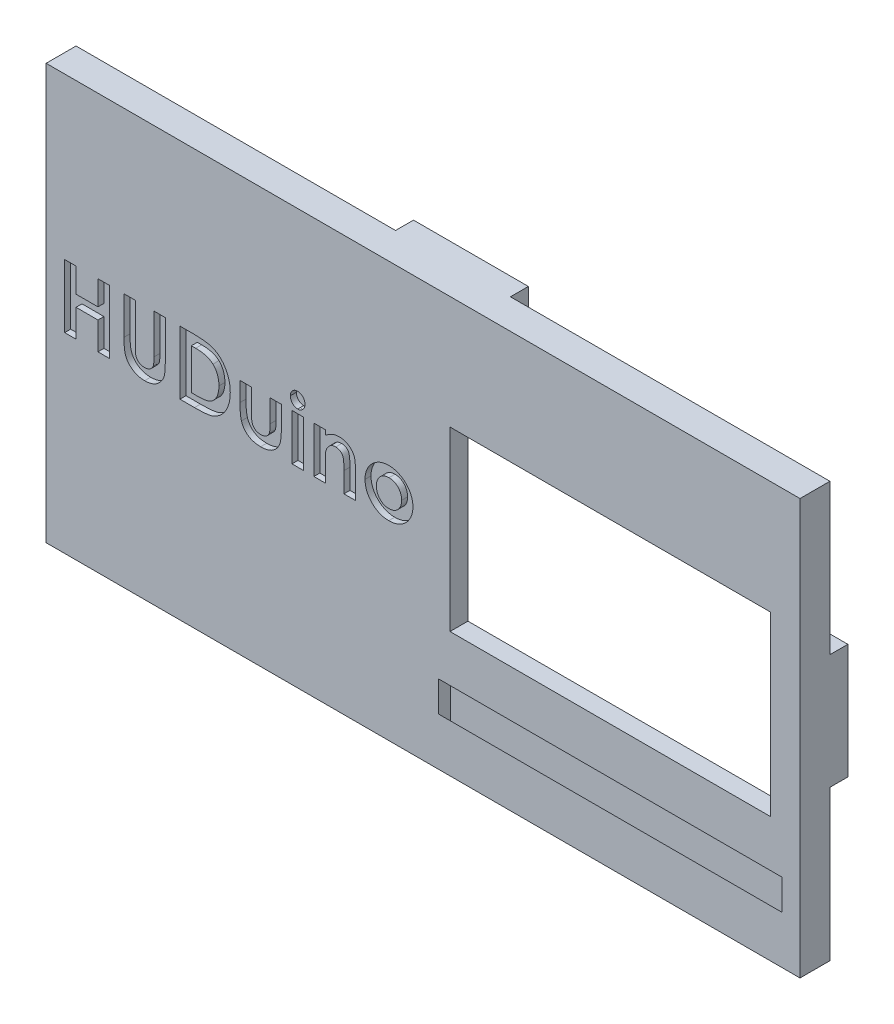
from build123d import *

# Parameters (mm, degrees)
CROQUIS1_W              = 63
CROQUIS1_H              = 34.7
SALIENTE_EXTRUIR1_DEPTH = 1.5
CROQUIS3_W              = 63
CROQUIS3_H              = 34.7
CROQUIS3_W_2            = 60
CROQUIS3_H_2            = 31.7
SALIENTE_EXTRUIR2_DEPTH = 1
CROQUIS4_W              = 9.6
CROQUIS4_H              = 1.5
CROQUIS4_W_2            = 1.5
CROQUIS4_H_2            = 9.6
SALIENTE_EXTRUIR3_DEPTH = 1.5
CROQUIS6_W              = 26.8
CROQUIS6_H              = 14.8
CORTAR_EXTRUIR1_DEPTH   = 21.5
CORTAR_EXTRUIR2_DEPTH   = 32
CROQUIS9_W              = 4.561385857
CROQUIS9_H              = 7.624030645
CROQUIS9_W_2            = 1.5
CROQUIS9_H_2            = 6.813692183
SALIENTE_EXTRUIR4_DEPTH = 1.5
CROQUIS10_W             = 28.7
CROQUIS10_H             = 6.574342804
SALIENTE_EXTRUIR5_DEPTH = 0.5
CROQUIS12_W             = 0.949786325
CROQUIS12_H             = 3.86698718
CORTAR_EXTRUIR3_DEPTH   = 0.5


with BuildPart() as part:
    # Croquis1 → Saliente-Extruir1 (new body)
    with BuildSketch(Plane.XY):
        with Locations((1.705737566, -2.941240876)):
            Rectangle(CROQUIS1_W, CROQUIS1_H)
    extrude(amount=SALIENTE_EXTRUIR1_DEPTH)

    # Croquis3 → Saliente-Extruir2 (add)
    with BuildSketch(Plane(origin=(0, 0, 0), x_dir=(-1, 0, 0), z_dir=(0, 0, -1))):
        with Locations((-1.705737566, -2.941240876)):
            Rectangle(CROQUIS3_W, CROQUIS3_H)
        with Locations((-1.705737566, -2.941240876)):
            Rectangle(CROQUIS3_W_2, CROQUIS3_H_2, mode=Mode.SUBTRACT)
    extrude(amount=SALIENTE_EXTRUIR2_DEPTH)

    # Croquis4 → Saliente-Extruir3 (add)
    with BuildSketch(Plane(origin=(0, 0, -1), x_dir=(-1, 0, 0), z_dir=(0, 0, -1))):
        with Locations((-1.705737566, 13.658759124)):
            Rectangle(CROQUIS4_W, CROQUIS4_H)
        with Locations((-32.455737566, -2.941240876)):
            Rectangle(CROQUIS4_W_2, CROQUIS4_H_2)
        with Locations((-1.705737566, -19.541240876)):
            Rectangle(CROQUIS4_W, CROQUIS4_H)
        with Locations((29.044262434, -2.941240876)):
            Rectangle(CROQUIS4_W_2, CROQUIS4_H_2)
    extrude(amount=SALIENTE_EXTRUIR3_DEPTH)

    # Croquis6 → Cortar-Extruir1 (cut)
    with BuildSketch(Plane.XY.offset(1.5)):
        with Locations((17.355737566, -2.441240876)):
            Rectangle(CROQUIS6_W, CROQUIS6_H)
    extrude(amount=-CORTAR_EXTRUIR1_DEPTH, mode=Mode.SUBTRACT)

    # Croquis8 → Cortar-Extruir2 (cut)
    with BuildSketch(Plane(origin=(33.205737566, 0, 0), x_dir=(0, 0, -1), z_dir=(1, 0, 0))):
        Polygon((0, -15.245656464), (-2.710635827, -12.535020636), (-2.868202565, -14.923038311), (0, -17.791240876), align=None)
    extrude(amount=-CORTAR_EXTRUIR2_DEPTH, mode=Mode.SUBTRACT)

    # Croquis9 → Saliente-Extruir4 (add)
    with BuildSketch(Plane.XY.offset(1.5)):
        with Locations((0.725044638, -15.289564016)):
            Rectangle(CROQUIS9_W, CROQUIS9_H)
        with Locations((32.455737566, -14.884394784)):
            Rectangle(CROQUIS9_W_2, CROQUIS9_H_2)
    extrude(amount=-SALIENTE_EXTRUIR4_DEPTH)

    # Croquis10 → Saliente-Extruir5 (add)
    with BuildSketch(Plane(origin=(0, 0, 0), x_dir=(-1, 0, 0), z_dir=(0, 0, -1))):
        with Locations((-17.355737566, -14.504069474)):
            Rectangle(CROQUIS10_W, CROQUIS10_H)
    extrude(amount=-SALIENTE_EXTRUIR5_DEPTH)

    # Croquis12 → Cortar-Extruir3 (cut)
    # profile 1 of 8: a face of its own
    with BuildSketch(Plane.XY.offset(1.5)):
        Polygon((-28.244970749, 0.982010034), (-27.295184424, 0.982010034), (-27.295184424, -1.053246376), (-25.463453655, -1.053246376), (-25.463453655, 0.982010034), (-24.51366733, 0.982010034), (-24.51366733, -4.309656633), (-25.463453655, -4.309656633), (-25.463453655, -2.003032701), (-27.295184424, -2.003032701), (-27.295184424, -4.309656633), (-28.244970749, -4.309656633), align=None)
    # profile 2 of 8: a face of its own
    with BuildSketch(Plane.XY.offset(1.5)):
        with BuildLine():
            Line((-23.292513484, 0.982010034), (-22.342727159, 0.982010034))
            Line((-22.342727159, 0.982010034), (-22.342727159, -2.460965394))
            add(Edge.make_bspline(
                [(-22.342727159, -2.460965394), (-22.342675514, -2.496660669), (-22.342575763, -2.565605726), (-22.337582166, -2.664519309), (-22.333012681, -2.755441603), (-22.324768032, -2.838273066), (-22.31258786, -2.913049131), (-22.300793478, -2.980250132), (-22.28483095, -3.038672913), (-22.260841821, -3.105173333), (-22.223882449, -3.179890187), (-22.163492886, -3.257761806), (-22.093808496, -3.328830961), (-22.010287741, -3.387986233), (-21.916417799, -3.435837516), (-21.812714443, -3.471290021), (-21.699323859, -3.490996907), (-21.620920489, -3.494005524), (-21.580566034, -3.495554069)],
                knots=[0, 0, 0, 0, 1.155499968, 2.231836252, 3.205919964, 4.102923608, 4.924856345, 5.658536265, 6.31071849, 6.882491295, 7.94666036, 8.992281882, 10.060072772, 11.158554251, 12.289267114, 13.461410017, 14.693379945, 16, 16, 16, 16], degree=3))
            add(Edge.make_bspline(
                [(-21.580566034, -3.495554069), (-21.537694406, -3.494303044), (-21.454101989, -3.491863756), (-21.333867606, -3.467919512), (-21.222469767, -3.429792075), (-21.122267146, -3.375374505), (-21.03335946, -3.31014551), (-20.958100967, -3.235764016), (-20.898707241, -3.152081667), (-20.85999662, -3.074878328), (-20.838262513, -3.003819378), (-20.821971717, -2.940330902), (-20.810028761, -2.865420785), (-20.799193719, -2.780258909), (-20.792682693, -2.683963163), (-20.785622547, -2.577307968), (-20.783034938, -2.459563562), (-20.782593899, -2.377575921), (-20.782363911, -2.334821897)],
                knots=[0, 0, 0, 0, 1.261321664, 2.459363699, 3.594844139, 4.716940403, 5.803436589, 6.833651888, 7.818396249, 8.814403945, 9.360733334, 10.004355033, 10.743453831, 11.592799886, 12.532235708, 13.585170094, 14.740740724, 16, 16, 16, 16], degree=3))
            Line((-20.782363911, -2.334821897), (-20.782363911, 0.982010034))
            Line((-20.782363911, 0.982010034), (-19.832577586, 0.982010034))
            Line((-19.832577586, 0.982010034), (-19.832577586, -2.174757461))
            add(Edge.make_bspline(
                [(-19.832577586, -2.174757461), (-19.832709481, -2.238713419), (-19.832963103, -2.36169449), (-19.836857963, -2.538426944), (-19.845149416, -2.699843691), (-19.85211328, -2.845991897), (-19.865590741, -2.976674676), (-19.879631094, -3.092450082), (-19.897526732, -3.192907832), (-19.924154365, -3.307266773), (-19.970105777, -3.438946904), (-20.044185478, -3.590570867), (-20.138224863, -3.739019912), (-20.249374717, -3.882660995), (-20.374873069, -4.016098933), (-20.511937352, -4.13324017), (-20.658389955, -4.232329025), (-20.815761204, -4.310942655), (-20.983917167, -4.372255361), (-21.164521622, -4.413454411), (-21.357451411, -4.441289006), (-21.490711663, -4.443962861), (-21.559365447, -4.445340394)],
                knots=[0, 0, 0, 0, 1.170808336, 2.251350247, 3.235597562, 4.129743112, 4.929140599, 5.639994148, 6.264258765, 6.79612947, 7.788252245, 8.809469599, 9.879094798, 10.999557536, 12.129761673, 13.226370002, 14.293821979, 15.358369427, 16.438775801, 17.562147481, 18.744053101, 20, 20, 20, 20], degree=3))
            add(Edge.make_bspline(
                [(-21.559365447, -4.445340394), (-21.604980387, -4.44457207), (-21.694977727, -4.443056184), (-21.827334605, -4.429690026), (-21.955283527, -4.409993335), (-22.078584078, -4.381257891), (-22.197664212, -4.344137065), (-22.312492292, -4.298443914), (-22.422641589, -4.244433307), (-22.527495723, -4.182602026), (-22.626925661, -4.11574214), (-22.717799493, -4.041625141), (-22.803244399, -3.965732262), (-22.880791912, -3.884869609), (-22.951024483, -3.799886101), (-23.013797467, -3.710589137), (-23.069017606, -3.61698665), (-23.118073931, -3.51739146), (-23.160061357, -3.406741503), (-23.195458335, -3.281100915), (-23.226381967, -3.138500405), (-23.249362587, -2.978618701), (-23.270196951, -2.801982756), (-23.283383955, -2.608132406), (-23.29028267, -2.397062089), (-23.29175109, -2.250731415), (-23.292513484, -2.174757461)],
                knots=[0, 0, 0, 0, 1.001158378, 1.975264943, 2.917723546, 3.841610987, 4.75185031, 5.653588123, 6.552117133, 7.442167995, 8.324307438, 9.179605724, 10.014504199, 10.831958861, 11.636465792, 12.43274043, 13.225645099, 14.020104002, 14.867201867, 15.819789774, 16.883317127, 18.068162734, 19.364263498, 20.787406516, 22.332041935, 24, 24, 24, 24], degree=3))
            Line((-23.292513484, -2.174757461), (-23.292513484, 0.982010034))
        make_face()
    # profile 3 of 8: a face of its own
    with BuildSketch(Plane.XY.offset(1.5)):
        with BuildLine():
            Line((-18.61142374, 0.982010034), (-17.41465057, 0.982010034))
            add(Edge.make_bspline(
                [(-17.41465057, 0.982010034), (-17.321348336, 0.981357819), (-17.140994063, 0.980097081), (-16.879696401, 0.965891595), (-16.636722826, 0.944044565), (-16.411916713, 0.913990017), (-16.205738951, 0.874219619), (-16.0184554, 0.824335449), (-15.849437494, 0.766752475), (-15.696831985, 0.69899442), (-15.557517833, 0.619995258), (-15.4252346, 0.531996533), (-15.30024202, 0.431774596), (-15.180786021, 0.321262928), (-15.068408207, 0.19843975), (-14.961237085, 0.065339461), (-14.86189669, -0.079968078), (-14.767384178, -0.23399885), (-14.681910186, -0.397405623), (-14.607356578, -0.568797513), (-14.544902567, -0.747071548), (-14.49415545, -0.932417723), (-14.45370414, -1.124220745), (-14.425401174, -1.322867654), (-14.407903999, -1.528174536), (-14.406129057, -1.667321091), (-14.405227159, -1.738025356)],
                knots=[0, 0, 0, 0, 1.44355588, 2.790409838, 4.047694926, 5.217575253, 6.298404546, 7.294384826, 8.214239204, 9.058592145, 9.873746385, 10.689560431, 11.514393297, 12.350027578, 13.205127629, 14.088021785, 14.991911688, 15.926770944, 16.882954281, 17.842803888, 18.816321264, 19.80318086, 20.814351908, 21.847355356, 22.906180909, 24, 24, 24, 24], degree=3))
            add(Edge.make_bspline(
                [(-14.405227159, -1.738025356), (-14.407588814, -1.837793677), (-14.412237872, -2.034193456), (-14.451398932, -2.322407869), (-14.514735626, -2.59869013), (-14.603792771, -2.860879052), (-14.71419979, -3.106639803), (-14.846093338, -3.331638497), (-14.997539547, -3.534667455), (-15.166774062, -3.714715757), (-15.350013824, -3.869469713), (-15.540436887, -4.002005152), (-15.73989832, -4.106520404), (-15.915651717, -4.172798703), (-16.068051839, -4.214018071), (-16.201857497, -4.238379115), (-16.353847072, -4.260719661), (-16.525437735, -4.277983954), (-16.715876755, -4.293379461), (-16.925923223, -4.301744781), (-17.15489707, -4.308695119), (-17.313941057, -4.30932773), (-17.39663007, -4.309656633)],
                knots=[0, 0, 0, 0, 1.315458931, 2.589557908, 3.828601765, 5.048913369, 6.235739168, 7.376350998, 8.481830359, 9.569842114, 10.627874879, 11.640079404, 12.624025415, 13.590060155, 14.111227486, 14.704434459, 15.382649715, 16.137166398, 16.978595427, 17.902333227, 18.909396075, 20, 20, 20, 20], degree=3))
            Line((-17.39663007, -4.309656633), (-18.61142374, -4.309656633))
            Line((-18.61142374, -4.309656633), (-18.61142374, 0.982010034))
        make_face()
        with BuildLine():
            Line((-17.661637415, 0.032223709), (-17.661637415, -3.359870308))
            Line((-17.661637415, -3.359870308), (-17.165543665, -3.359870308))
            add(Edge.make_bspline(
                [(-17.165543665, -3.359870308), (-17.106516128, -3.359762145), (-16.992986523, -3.359554112), (-16.829075472, -3.349645309), (-16.677499311, -3.339699604), (-16.538675294, -3.320822322), (-16.411593101, -3.299794359), (-16.297998511, -3.270531069), (-16.195549844, -3.239792461), (-16.105498492, -3.200658404), (-16.023018791, -3.156610419), (-15.946652009, -3.105003097), (-15.872936683, -3.047695112), (-15.803250981, -2.983000956), (-15.737331159, -2.911777299), (-15.675567241, -2.833657159), (-15.617134842, -2.748878881), (-15.56353381, -2.656994223), (-15.5145529, -2.558973507), (-15.471101345, -2.455766207), (-15.435073593, -2.346512827), (-15.405129532, -2.232236112), (-15.383731105, -2.111941152), (-15.366027988, -1.986518956), (-15.356901515, -1.855472611), (-15.355648964, -1.766304298), (-15.355013484, -1.721064886)],
                knots=[0, 0, 0, 0, 1.50275155, 2.890291501, 4.180787663, 5.369391935, 6.45668281, 7.458360028, 8.354766181, 9.177074746, 9.954075863, 10.732690366, 11.5210699, 12.329727389, 13.151100085, 13.990027547, 14.863562427, 15.770965086, 16.696477834, 17.652329173, 18.619756807, 19.62365428, 20.657822005, 21.729286259, 22.847956731, 24, 24, 24, 24], degree=3))
            add(Edge.make_bspline(
                [(-15.355013484, -1.721064886), (-15.356279144, -1.651739764), (-15.358747085, -1.516561147), (-15.382547367, -1.319670541), (-15.421289687, -1.13426854), (-15.476571244, -0.96104322), (-15.546255361, -0.799507728), (-15.633481276, -0.651030611), (-15.734495124, -0.513117657), (-15.814374118, -0.432213494), (-15.854287322, -0.391788043)],
                knots=[0, 0, 0, 0, 1.13821349, 2.219428113, 3.251817212, 4.244760574, 5.201143372, 6.134805572, 7.068016741, 8, 8, 8, 8], degree=3))
            add(Edge.make_bspline(
                [(-15.854287322, -0.391788043), (-15.89364552, -0.357340094), (-15.974030184, -0.286984058), (-16.115159237, -0.202679535), (-16.270676144, -0.128609748), (-16.444138667, -0.069880668), (-16.633870365, -0.023435207), (-16.841001287, 0.008597092), (-17.064422199, 0.029180707), (-17.219203002, 0.031187644), (-17.299107367, 0.032223709)],
                knots=[0, 0, 0, 0, 0.813307809, 1.661089106, 2.549956539, 3.493439533, 4.508053171, 5.589449661, 6.755572447, 8, 8, 8, 8], degree=3))
            Line((-17.299107367, 0.032223709), (-17.661637415, 0.032223709))
        make_face(mode=Mode.SUBTRACT)
    # profile 4 of 8: a face of its own
    with BuildSketch(Plane.XY.offset(1.5)):
        with BuildLine():
            Line((-13.591124595, -0.442669453), (-12.64133827, -0.442669453))
            Line((-12.64133827, -0.442669453), (-12.64133827, -2.298780898))
            add(Edge.make_bspline(
                [(-12.64133827, -2.298780898), (-12.641253929, -2.342246548), (-12.641092056, -2.425667745), (-12.636587688, -2.545476915), (-12.630267168, -2.655036915), (-12.622379587, -2.754476935), (-12.610606867, -2.843557791), (-12.597015758, -2.922109423), (-12.581607825, -2.990697806), (-12.556552579, -3.067148704), (-12.517353196, -3.150809508), (-12.458155188, -3.239625275), (-12.386449134, -3.316424945), (-12.303203831, -3.381890074), (-12.207569141, -3.433478033), (-12.100862658, -3.468438406), (-11.984426967, -3.491935411), (-11.903329683, -3.49431606), (-11.861156646, -3.495554069)],
                knots=[0, 0, 0, 0, 1.267339619, 2.432334223, 3.495366327, 4.467371443, 5.340232306, 6.114347373, 6.791623365, 7.387877112, 8.457231658, 9.474542289, 10.487879852, 11.508108106, 12.54995813, 13.638205937, 14.771795776, 16, 16, 16, 16], degree=3))
            add(Edge.make_bspline(
                [(-11.861156646, -3.495554069), (-11.819021034, -3.494141056), (-11.737714019, -3.491414436), (-11.620503637, -3.470151527), (-11.513545818, -3.433716823), (-11.415742038, -3.384297447), (-11.329976536, -3.31815803), (-11.255304021, -3.239348223), (-11.192431515, -3.146596726), (-11.162218377, -3.077406767), (-11.146696844, -3.041861494)],
                knots=[0, 0, 0, 0, 1.116871431, 2.155171802, 3.144773418, 4.104381479, 5.046960687, 6.001340237, 6.973219418, 8, 8, 8, 8], degree=3))
            add(Edge.make_bspline(
                [(-11.146696844, -3.041861494), (-11.141000963, -3.026071965), (-11.128427962, -2.991218401), (-11.117237742, -2.931091207), (-11.105193734, -2.860180916), (-11.095666496, -2.777042438), (-11.090275648, -2.682190656), (-11.084499906, -2.575506024), (-11.081556485, -2.457094795), (-11.081174778, -2.374044115), (-11.080975022, -2.33058178)],
                knots=[0, 0, 0, 0, 0.56094539, 1.238222264, 2.041156151, 2.969685991, 4.036367568, 5.220421584, 6.545382566, 8, 8, 8, 8], degree=3))
            Line((-11.080975022, -2.33058178), (-11.080975022, -0.442669453))
            Line((-11.080975022, -0.442669453), (-10.131188697, -0.442669453))
            Line((-10.131188697, -0.442669453), (-10.131188697, -2.067694493))
            add(Edge.make_bspline(
                [(-10.131188697, -2.067694493), (-10.131353152, -2.148266681), (-10.131668461, -2.302747951), (-10.140705029, -2.524346313), (-10.153176517, -2.725823454), (-10.169237394, -2.907734104), (-10.192379134, -3.070153756), (-10.220786852, -3.212701533), (-10.252214858, -3.336319409), (-10.281035511, -3.409563855), (-10.294433222, -3.443612629)],
                knots=[0, 0, 0, 0, 1.388070971, 2.661352173, 3.82033814, 4.865898334, 5.806910977, 6.645039373, 7.370126333, 8, 8, 8, 8], degree=3))
            add(Edge.make_bspline(
                [(-10.294433222, -3.443612629), (-10.311605636, -3.480259629), (-10.345502507, -3.552597659), (-10.404319878, -3.655446318), (-10.467728299, -3.752887273), (-10.538744767, -3.842626862), (-10.615919615, -3.925577142), (-10.697071352, -4.003623776), (-10.785854632, -4.073588585), (-10.879966975, -4.137271964), (-10.98072159, -4.193803162), (-11.087428381, -4.243899378), (-11.201240483, -4.284669109), (-11.321171012, -4.319227205), (-11.447772769, -4.344998956), (-11.580790728, -4.36451909), (-11.720370779, -4.37460717), (-11.815561789, -4.376518941), (-11.864336734, -4.377498513)],
                knots=[0, 0, 0, 0, 0.997311338, 1.968606903, 2.91805772, 3.860812155, 4.785445165, 5.709667791, 6.633356648, 7.568312411, 8.508286151, 9.478643871, 10.470653671, 11.485274776, 12.552984541, 13.653035246, 14.797438149, 16, 16, 16, 16], degree=3))
            add(Edge.make_bspline(
                [(-11.864336734, -4.377498513), (-11.917027381, -4.37687058), (-12.020125109, -4.375641927), (-12.170749449, -4.360595744), (-12.31429647, -4.34112794), (-12.449163479, -4.308029104), (-12.577233956, -4.269682447), (-12.697037579, -4.220741913), (-12.809063896, -4.163201712), (-12.913533335, -4.097402973), (-13.009635667, -4.022742722), (-13.099507837, -3.942448221), (-13.180248383, -3.853324807), (-13.254493158, -3.758124645), (-13.321413546, -3.655971563), (-13.381042763, -3.547228784), (-13.433431318, -3.431401694), (-13.461383211, -3.350223442), (-13.475581392, -3.308988898)],
                knots=[0, 0, 0, 0, 1.211240017, 2.369985978, 3.478996442, 4.539426614, 5.559871561, 6.551301256, 7.510778031, 8.453136967, 9.386094087, 10.30661716, 11.221130616, 12.147659962, 13.080758632, 14.026335491, 14.997475882, 16, 16, 16, 16], degree=3))
            add(Edge.make_bspline(
                [(-13.475581392, -3.308988898), (-13.485267855, -3.276964573), (-13.506134753, -3.207976711), (-13.528664609, -3.093326937), (-13.546684808, -2.961186653), (-13.564214287, -2.811425881), (-13.576443172, -2.643793546), (-13.584436117, -2.458555871), (-13.589836702, -2.255350624), (-13.59068265, -2.113986184), (-13.591124595, -2.04013373)],
                knots=[0, 0, 0, 0, 0.627914866, 1.352675004, 2.190563461, 3.132055958, 4.183353232, 5.345633452, 6.613289997, 8, 8, 8, 8], degree=3))
            Line((-13.591124595, -2.04013373), (-13.591124595, -0.442669453))
        make_face()
    # profile 5 of 8: a face of its own
    with BuildSketch(Plane.XY.offset(1.5)):
        with BuildLine():
            add(Edge.make_bspline(
                [(-8.776471149, 1.185535675), (-8.735535365, 1.18352721), (-8.65515401, 1.179583397), (-8.539996779, 1.141139988), (-8.43430578, 1.080804206), (-8.340872006, 0.998022075), (-8.263162529, 0.89916507), (-8.203789603, 0.78848808), (-8.17071542, 0.66586154), (-8.166121905, 0.581152409), (-8.163774167, 0.537857723)],
                knots=[0, 0, 0, 0, 0.989868614, 1.943702388, 2.910836514, 3.924849579, 4.949916355, 5.946401046, 6.950409252, 8, 8, 8, 8], degree=3))
            add(Edge.make_bspline(
                [(-8.163774167, 0.537857723), (-8.166037907, 0.494882096), (-8.17044891, 0.41114204), (-8.204550826, 0.290180212), (-8.261540729, 0.179556978), (-8.339879604, 0.082168183), (-8.432300434, 0.000719307), (-8.535682004, -0.060711834), (-8.649735694, -0.097016645), (-8.728869774, -0.101290139), (-8.769050944, -0.103460052)],
                knots=[0, 0, 0, 0, 1.05296456, 2.051751585, 3.055639087, 4.085634717, 5.099016424, 6.062201612, 7.016062274, 8, 8, 8, 8], degree=3))
            add(Edge.make_bspline(
                [(-8.769050944, -0.103460052), (-8.810344063, -0.101458767), (-8.891424733, -0.097529166), (-9.00752649, -0.058995808), (-9.114627137, 0.00086479), (-9.207655596, 0.085338288), (-9.28625502, 0.184897747), (-9.343034513, 0.298151393), (-9.378551491, 0.421616451), (-9.382767325, 0.507580182), (-9.384928014, 0.551638105)],
                knots=[0, 0, 0, 0, 0.989065327, 1.942068821, 2.907541208, 3.917690034, 4.939857478, 5.938239964, 6.943311734, 8, 8, 8, 8], degree=3))
            add(Edge.make_bspline(
                [(-9.384928014, 0.551638105), (-9.382576593, 0.593883981), (-9.377957567, 0.676869905), (-9.344685265, 0.796770098), (-9.286673759, 0.905586434), (-9.209524031, 1.002633769), (-9.11691092, 1.083871702), (-9.011283369, 1.142375046), (-8.89690115, 1.179230633), (-8.817028982, 1.183412294), (-8.776471149, 1.185535675)],
                knots=[0, 0, 0, 0, 1.038616768, 2.040212704, 3.031499824, 4.052181184, 5.074969369, 6.039807101, 7.004644834, 8, 8, 8, 8], degree=3))
        make_face()
    # profile 6 of 8: a face of its own
    with BuildSketch(Plane.XY.offset(1.5)):
        with Locations((-8.774351091, -2.376163043)):
            Rectangle(CROQUIS12_W, CROQUIS12_H)
    # profile 7 of 8: a face of its own
    with BuildSketch(Plane.XY.offset(1.5)):
        with BuildLine():
            Line((-7.417513484, -0.442669453), (-6.467727159, -0.442669453))
            Line((-6.467727159, -0.442669453), (-6.467727159, -0.851840794))
            add(Edge.make_bspline(
                [(-6.467727159, -0.851840794), (-6.41354232, -0.80969471), (-6.309984559, -0.729145351), (-6.152558883, -0.626444508), (-6.003968536, -0.542387992), (-5.860901279, -0.478450304), (-5.720665299, -0.432449887), (-5.580989373, -0.399401332), (-5.439793443, -0.378239433), (-5.344875506, -0.37596425), (-5.297454723, -0.374827573)],
                knots=[0, 0, 0, 0, 1.276643801, 2.439914479, 3.493451431, 4.44993799, 5.350072675, 6.235028322, 7.118224225, 8, 8, 8, 8], degree=3))
            add(Edge.make_bspline(
                [(-5.297454723, -0.374827573), (-5.24935272, -0.376126559), (-5.15492445, -0.378676578), (-5.015884024, -0.396511891), (-4.883044401, -0.428995648), (-4.754911907, -0.47212529), (-4.632790713, -0.529053945), (-4.515184758, -0.596647485), (-4.404620179, -0.678980991), (-4.336529616, -0.741682236), (-4.302087135, -0.77339862)],
                knots=[0, 0, 0, 0, 1.048836932, 2.058954983, 3.049370783, 4.026390553, 5.001981509, 5.982488534, 6.97947532, 8, 8, 8, 8], degree=3))
            add(Edge.make_bspline(
                [(-4.302087135, -0.77339862), (-4.274462997, -0.802790433), (-4.219012547, -0.861789173), (-4.149235121, -0.962751128), (-4.089358242, -1.072818138), (-4.040297459, -1.193259863), (-4.004043517, -1.324738051), (-3.976152864, -1.465664634), (-3.960502933, -1.616828697), (-3.958570875, -1.720676982), (-3.957577586, -1.774066355)],
                knots=[0, 0, 0, 0, 0.889584746, 1.785680191, 2.700364693, 3.65222533, 4.649950538, 5.707241244, 6.821271309, 8, 8, 8, 8], degree=3))
            Line((-3.957577586, -1.774066355), (-3.957577586, -4.309656633))
            Line((-3.957577586, -4.309656633), (-4.907363911, -4.309656633))
            Line((-4.907363911, -4.309656633), (-4.907363911, -2.630570094))
            add(Edge.make_bspline(
                [(-4.907363911, -2.630570094), (-4.90756477, -2.575801217), (-4.907949679, -2.470846828), (-4.910904926, -2.320641324), (-4.916675289, -2.184986249), (-4.921934825, -2.063634612), (-4.932261385, -1.957017294), (-4.941574045, -1.864459326), (-4.955863417, -1.7868004), (-4.974456208, -1.703266574), (-5.006923801, -1.613828337), (-5.057328157, -1.519590378), (-5.12127315, -1.439533131), (-5.196147012, -1.373095355), (-5.281867051, -1.320536981), (-5.377397464, -1.283558891), (-5.482226095, -1.260513237), (-5.555269454, -1.25805082), (-5.59320292, -1.256772017)],
                knots=[0, 0, 0, 0, 1.49886392, 2.872294502, 4.110984203, 5.214877267, 6.195405875, 7.042225351, 7.75923308, 8.355011229, 9.382752534, 10.352059385, 11.267231453, 12.171456522, 13.078624015, 14.003401117, 14.963110155, 16, 16, 16, 16], degree=3))
            add(Edge.make_bspline(
                [(-5.59320292, -1.256772017), (-5.642536989, -1.259273761), (-5.739044017, -1.264167658), (-5.878622128, -1.301072108), (-6.006822297, -1.363835715), (-6.122597023, -1.450687925), (-6.224843649, -1.557917741), (-6.309056684, -1.685801598), (-6.378128672, -1.831253025), (-6.407830654, -1.937456193), (-6.423205925, -1.992432407)],
                knots=[0, 0, 0, 0, 0.984188326, 1.925263693, 2.85911992, 3.81709677, 4.80007086, 5.801799564, 6.862098548, 8, 8, 8, 8], degree=3))
            add(Edge.make_bspline(
                [(-6.423205925, -1.992432407), (-6.427027291, -2.009698056), (-6.435549705, -2.048203924), (-6.442558312, -2.113255378), (-6.452307793, -2.19043263), (-6.455960684, -2.281132372), (-6.46231266, -2.384925358), (-6.464661924, -2.501948905), (-6.467015392, -2.631973549), (-6.467482043, -2.722790822), (-6.467727159, -2.770493973)],
                knots=[0, 0, 0, 0, 0.543362196, 1.211806945, 2.009705693, 2.934833164, 4.000995085, 5.207458376, 6.533175157, 8, 8, 8, 8], degree=3))
            Line((-6.467727159, -2.770493973), (-6.467727159, -4.309656633))
            Line((-6.467727159, -4.309656633), (-7.417513484, -4.309656633))
            Line((-7.417513484, -4.309656633), (-7.417513484, -0.442669453))
        make_face()
    # profile 8 of 8: a face of its own
    with BuildSketch(Plane.XY.offset(1.5)):
        with BuildLine():
            add(Edge.make_bspline(
                [(-1.165460198, -0.374827573), (-1.120556135, -0.375626672), (-1.031625741, -0.377209249), (-0.89917503, -0.390382759), (-0.769039862, -0.411875884), (-0.640472239, -0.439705728), (-0.51466603, -0.478699504), (-0.390961398, -0.525466507), (-0.268252266, -0.579160497), (-0.149584249, -0.643075125), (-0.034100061, -0.712396369), (0.075385822, -0.788863388), (0.177964195, -0.871875561), (0.275539263, -0.959508185), (0.363563869, -1.055576498), (0.447663258, -1.155451527), (0.523293745, -1.262711444), (0.593316682, -1.374742574), (0.655657599, -1.490897063), (0.70978922, -1.610366899), (0.756770378, -1.731500326), (0.793555683, -1.855772834), (0.824010525, -1.981545723), (0.843229694, -2.110360246), (0.856893192, -2.240893155), (0.858425303, -2.328778651), (0.859195918, -2.372982955)],
                knots=[0, 0, 0, 0, 1.022364134, 2.024744242, 3.027414945, 4.024939316, 5.017584196, 6.023349371, 7.035562955, 8.064994934, 9.090267829, 10.101425541, 11.102933353, 12.093946398, 13.084502048, 14.067315274, 15.065326281, 16.070028806, 17.074376865, 18.064572984, 19.055292013, 20.030201733, 21.013838017, 21.999348303, 22.993720005, 24, 24, 24, 24], degree=3))
            add(Edge.make_bspline(
                [(0.859195918, -2.372982955), (0.858382661, -2.417532605), (0.856765722, -2.50610741), (0.843724023, -2.637868142), (0.822148629, -2.76728842), (0.794211972, -2.89513068), (0.755364123, -3.01975906), (0.709974558, -3.143010629), (0.65425708, -3.263205424), (0.592657304, -3.381654656), (0.522184149, -3.494872725), (0.446619129, -3.603207128), (0.362871989, -3.703815744), (0.275552045, -3.799818726), (0.180517512, -3.887969683), (0.079285321, -3.969699952), (-0.02726814, -4.04600872), (-0.139909102, -4.115105642), (-0.257194823, -4.175818643), (-0.377147301, -4.230556369), (-0.500467951, -4.276129433), (-0.626901554, -4.313293012), (-0.756524789, -4.342067841), (-0.88905148, -4.361614925), (-1.024196215, -4.375209696), (-1.115251416, -4.376730663), (-1.161220081, -4.377498513)],
                knots=[0, 0, 0, 0, 1.012026251, 2.012137606, 3.004615893, 3.992048833, 4.982446996, 5.968083444, 6.973977695, 7.990229942, 8.999482246, 10.001782172, 10.988562221, 11.971415814, 12.948383116, 13.930088534, 14.925840678, 15.924049238, 16.929462851, 17.924729459, 18.917889337, 19.913673841, 20.916777188, 21.931792057, 22.95587778, 24, 24, 24, 24], degree=3))
            add(Edge.make_bspline(
                [(-1.161220081, -4.377498513), (-1.228435643, -4.375525604), (-1.360918539, -4.37163697), (-1.556034523, -4.345000842), (-1.743476574, -4.299153084), (-1.923550128, -4.23524232), (-2.096489104, -4.153343057), (-2.260784229, -4.051980282), (-2.418069793, -3.933149538), (-2.565621489, -3.797855192), (-2.700798832, -3.649425044), (-2.818892504, -3.490976764), (-2.919163589, -3.324885228), (-3.001521872, -3.150961034), (-3.065085673, -2.968965686), (-3.110989582, -2.779443285), (-3.137658275, -2.581861112), (-3.14151402, -2.447618084), (-3.143475022, -2.379343131)],
                knots=[0, 0, 0, 0, 1.029999031, 2.030143771, 3.011211297, 3.982305373, 4.953580601, 5.938004764, 6.935448627, 7.970290061, 9.001484052, 10.007591832, 10.993831261, 11.969999897, 12.951306496, 13.942897864, 14.953773953, 16, 16, 16, 16], degree=3))
            add(Edge.make_bspline(
                [(-3.143475022, -2.379343131), (-3.141445634, -2.306440448), (-3.137456913, -2.163151683), (-3.105784708, -1.953230378), (-3.055207613, -1.752240676), (-2.98260738, -1.560744811), (-2.889866968, -1.378389593), (-2.776651942, -1.205559631), (-2.642402788, -1.042215775), (-2.539594818, -0.943419812), (-2.487316836, -0.89318194)],
                knots=[0, 0, 0, 0, 1.043912699, 2.05178951, 3.033892, 4.007821512, 4.978932272, 5.95884105, 6.962068106, 8, 8, 8, 8], degree=3))
            add(Edge.make_bspline(
                [(-2.487316836, -0.89318194), (-2.439346562, -0.851540395), (-2.344711141, -0.769390247), (-2.19095973, -0.665196253), (-2.033535634, -0.57520443), (-1.870552058, -0.501214413), (-1.701554646, -0.445427134), (-1.527409414, -0.404818987), (-1.348152572, -0.379876273), (-1.22666713, -0.376519025), (-1.165460198, -0.374827573)],
                knots=[0, 0, 0, 0, 1.048115528, 2.067714963, 3.060638214, 4.039924844, 5.017819947, 5.994373833, 6.98952318, 8, 8, 8, 8], degree=3))
        make_face()
        with BuildLine():
            add(Edge.make_bspline(
                [(-1.144259611, -1.256772017), (-1.181032731, -1.257994234), (-1.253421014, -1.260400181), (-1.359978468, -1.273312255), (-1.46076163, -1.299776658), (-1.557772242, -1.333432137), (-1.649294176, -1.378441598), (-1.737833892, -1.43111304), (-1.81878752, -1.497024868), (-1.896072664, -1.569325321), (-1.966230348, -1.649613034), (-2.026011358, -1.737086437), (-2.079427013, -1.828398981), (-2.119929397, -1.926893732), (-2.15344899, -2.029878544), (-2.17613465, -2.139017336), (-2.191922284, -2.25309097), (-2.193094293, -2.331232191), (-2.193688697, -2.370862896)],
                knots=[0, 0, 0, 0, 1.030650113, 2.02884584, 2.99876339, 3.944280128, 4.900564847, 5.851248946, 6.823638398, 7.81794922, 8.81432732, 9.802856497, 10.78262424, 11.771747962, 12.779760563, 13.812642396, 14.89064281, 16, 16, 16, 16], degree=3))
            add(Edge.make_bspline(
                [(-2.193688697, -2.370862896), (-2.192993163, -2.41189118), (-2.191633875, -2.492073082), (-2.177558159, -2.60914944), (-2.154346841, -2.720254129), (-2.121370831, -2.825215514), (-2.079897931, -2.924786996), (-2.029015492, -3.018409912), (-1.968186507, -3.105521343), (-1.899221202, -3.186014018), (-1.823707139, -3.259078109), (-1.740964732, -3.321778979), (-1.654458921, -3.376257713), (-1.562196144, -3.420012544), (-1.465486796, -3.453794824), (-1.364043788, -3.478667581), (-1.257334035, -3.492067816), (-1.184574848, -3.494376005), (-1.147439699, -3.495554069)],
                knots=[0, 0, 0, 0, 1.141730614, 2.231293227, 3.276944405, 4.297399982, 5.28939179, 6.275415646, 7.257752684, 8.24146775, 9.222424823, 10.176631434, 11.126518621, 12.063689483, 13.012557477, 13.974037417, 14.965980454, 16, 16, 16, 16], degree=3))
            add(Edge.make_bspline(
                [(-1.147439699, -3.495554069), (-1.110285977, -3.49450918), (-1.037443114, -3.492460591), (-0.930608051, -3.477119894), (-0.828647, -3.45297666), (-0.731111678, -3.418903627), (-0.638790669, -3.374212247), (-0.551330559, -3.31947288), (-0.46796195, -3.255899898), (-0.391434481, -3.181457225), (-0.320594466, -3.100713523), (-0.25847201, -3.013142237), (-0.206560143, -2.919519297), (-0.163983116, -2.82043378), (-0.130942462, -2.716021878), (-0.108115412, -2.605895505), (-0.092319336, -2.490395951), (-0.091173834, -2.411199327), (-0.090590407, -2.370862896)],
                knots=[0, 0, 0, 0, 1.031504075, 2.022346795, 2.991027682, 3.937587355, 4.885570121, 5.833146507, 6.798790848, 7.791235734, 8.792807298, 9.778388351, 10.766749885, 11.760164525, 12.768777521, 13.802286646, 14.880660483, 16, 16, 16, 16], degree=3))
            add(Edge.make_bspline(
                [(-0.090590407, -2.370862896), (-0.091294789, -2.330540564), (-0.092677016, -2.251415067), (-0.106753735, -2.135759301), (-0.129737264, -2.025988888), (-0.163138591, -1.922572536), (-0.204364982, -1.824330431), (-0.255282591, -1.731765435), (-0.316411565, -1.645333456), (-0.38571213, -1.565463072), (-0.462358196, -1.493424236), (-0.543663995, -1.429183082), (-0.631488742, -1.376050712), (-0.724184789, -1.332250672), (-0.821998759, -1.298552794), (-0.924820837, -1.273539077), (-1.032966143, -1.260329521), (-1.106774071, -1.257970245), (-1.144259611, -1.256772017)],
                knots=[0, 0, 0, 0, 1.123894411, 2.205445421, 3.243160173, 4.246488011, 5.231014757, 6.210004299, 7.185865357, 8.177612767, 9.153374344, 10.115157457, 11.061423229, 12.009021698, 12.96873347, 13.94135618, 14.954456845, 16, 16, 16, 16], degree=3))
        make_face(mode=Mode.SUBTRACT)
    extrude(amount=-CORTAR_EXTRUIR3_DEPTH, mode=Mode.SUBTRACT)


solid = part.part
